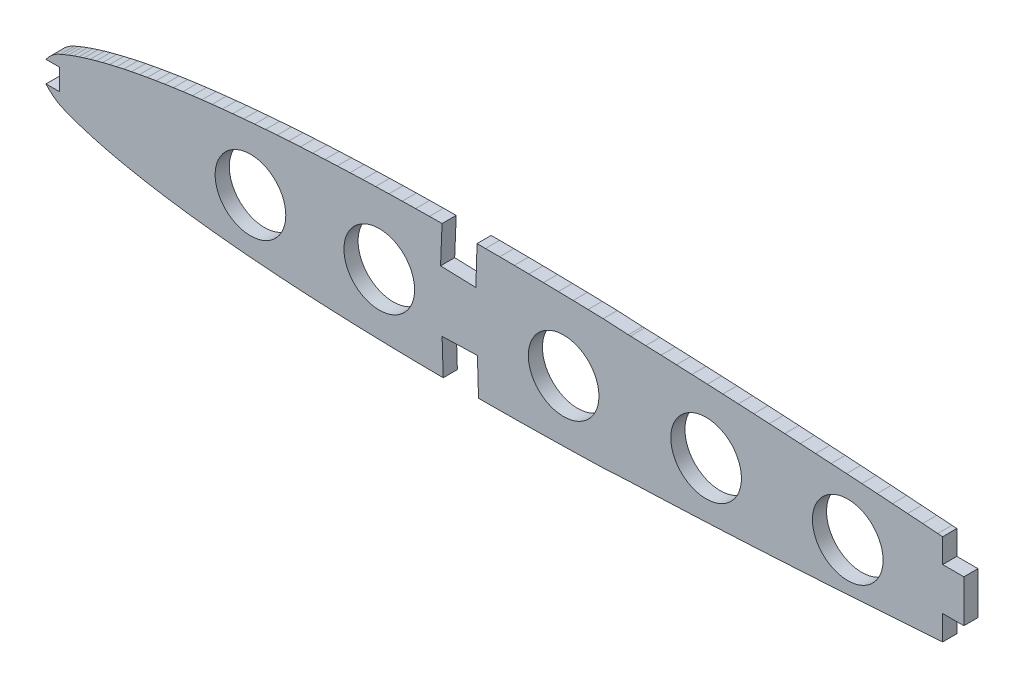
from build123d import *

# Parameters (mm, degrees)
MODEL_R         = 4.999197418
EXTRUDE_1_DEPTH = 2


with BuildPart() as part:
    # Model → 凸台-拉伸1 (new body)
    with BuildSketch(Plane.XY):
        with BuildLine():
            Line((15.194094226, 17.721853744), (17.133079466, 17.721853744))
            Line((17.133079466, 17.721853744), (17.133079466, 14.721853744))
            Line((17.133079466, 14.721853744), (15.194094226, 14.721853744))
            ThreePointArc((15.194094226, 14.721853744), (16.131604287, 13.801473468), (17.226994751, 13.076115145))
            Line((17.226994751, 13.076115145), (17.74383436, 12.854853744))
            Line((17.74383436, 12.854853744), (18.36183436, 12.607853744))
            Line((18.36183436, 12.607853744), (19.09783436, 12.332853744))
            Line((19.09783436, 12.332853744), (19.84083436, 12.076853744))
            Line((19.84083436, 12.076853744), (20.58983436, 11.836853744))
            Line((20.58983436, 11.836853744), (21.45683436, 11.576853744))
            Line((21.45683436, 11.576853744), (22.32783436, 11.331853744))
            Line((22.32783436, 11.331853744), (23.20283436, 11.101853744))
            Line((23.20283436, 11.101853744), (24.19583436, 10.855853744))
            Line((24.19583436, 10.855853744), (25.19083436, 10.622853744))
            Line((25.19083436, 10.622853744), (26.18983436, 10.403853744))
            Line((26.18983436, 10.403853744), (27.30283436, 10.174853744))
            Line((27.30283436, 10.174853744), (28.41883436, 9.959853744))
            Line((28.41883436, 9.959853744), (29.53783436, 9.756853744))
            Line((29.53783436, 9.756853744), (30.76783436, 9.546853744))
            Line((30.76783436, 9.546853744), (31.99983436, 9.349853744))
            Line((31.99983436, 9.349853744), (33.23483436, 9.164853744))
            Line((33.23483436, 9.164853744), (34.57683436, 8.974853744))
            Line((34.57683436, 8.974853744), (35.91983436, 8.797853744))
            Line((35.91983436, 8.797853744), (37.26583436, 8.632853744))
            Line((37.26583436, 8.632853744), (38.71483436, 8.465853744))
            Line((38.71483436, 8.465853744), (40.16583436, 8.310853744))
            Line((40.16583436, 8.310853744), (41.61783436, 8.165853744))
            Line((41.61783436, 8.165853744), (43.16683436, 8.020853744))
            Line((43.16683436, 8.020853744), (44.71683436, 7.887853744))
            Line((44.71683436, 7.887853744), (46.26883436, 7.763853744))
            Line((46.26883436, 7.763853744), (47.91283436, 7.642853744))
            Line((47.91283436, 7.642853744), (49.55683436, 7.531853744))
            Line((49.55683436, 7.531853744), (51.20283436, 7.430853744))
            Line((51.20283436, 7.430853744), (52.93483436, 7.333853744))
            Line((52.93483436, 7.333853744), (54.66683436, 7.246853744))
            Line((54.66683436, 7.246853744), (56.40083436, 7.168853744))
            Line((56.40083436, 7.168853744), (58.21383436, 7.095853744))
            Line((58.21383436, 7.095853744), (60.02683436, 7.031853744))
            Line((60.02683436, 7.031853744), (61.84083436, 6.975853744))
            Line((61.84083436, 6.975853744), (63.72783436, 6.926853744))
            Line((63.72783436, 6.926853744), (65.61483436, 6.885853744))
            Line((65.61483436, 6.885853744), (67.50183436, 6.852853744))
            Line((67.50183436, 6.852853744), (69.45583436, 6.826853744))
            Line((69.45583436, 6.826853744), (71.40883436, 6.808853744))
            Line((71.40883436, 6.808853744), (71.24683436, 11.805853744))
            Line((71.24683436, 11.805853744), (76.24383436, 11.967853744))
            Line((76.24383436, 11.967853744), (76.40583436, 6.796082515))
            Line((76.40583436, 6.796082515), (77.38783436, 6.797853744))
            Line((77.38783436, 6.797853744), (79.40083436, 6.808853744))
            Line((79.40083436, 6.808853744), (81.46383436, 6.825853744))
            Line((81.46383436, 6.825853744), (83.52683436, 6.850853744))
            Line((83.52683436, 6.850853744), (85.58983436, 6.881853744))
            Line((85.58983436, 6.881853744), (87.69483436, 6.919853744))
            Line((87.69483436, 6.919853744), (89.79983436, 6.964853744))
            Line((89.79983436, 6.964853744), (91.90583436, 7.015853744))
            Line((91.90583436, 7.015853744), (94.04583436, 7.072853744))
            Line((94.04583436, 7.072853744), (97.601964333, 7.270653793))
            Line((97.601964333, 7.270653793), (97.90379269, 7.281104913))
            Line((97.90379269, 7.281104913), (100.06879269, 7.362104913))
            Line((100.06879269, 7.362104913), (102.23479269, 7.447104913))
            Line((102.23479269, 7.447104913), (104.41879269, 7.538104913))
            Line((104.41879269, 7.538104913), (106.60179269, 7.634104913))
            Line((106.60179269, 7.634104913), (108.78479269, 7.734104913))
            Line((108.78479269, 7.734104913), (110.97679269, 7.840104913))
            Line((110.97679269, 7.840104913), (113.16779269, 7.951104913))
            Line((113.16779269, 7.951104913), (115.35879269, 8.067104913))
            Line((115.35879269, 8.067104913), (117.55079269, 8.189104913))
            Line((117.55079269, 8.189104913), (119.74079269, 8.314104913))
            Line((119.74079269, 8.314104913), (121.93279269, 8.442104913))
            Line((121.93279269, 8.442104913), (124.11679269, 8.572104913))
            Line((124.11679269, 8.572104913), (126.29979269, 8.704104913))
            Line((126.29979269, 8.704104913), (128.48279269, 8.840104913))
            Line((128.48279269, 8.840104913), (130.64879269, 8.980104913))
            Line((130.64879269, 8.980104913), (132.81379269, 9.124104913))
            Line((132.81379269, 9.124104913), (134.97979269, 9.271104913))
            Line((134.97979269, 9.271104913), (137.11979269, 9.419104913))
            Line((137.11979269, 9.419104913), (139.25979269, 9.570104913))
            Line((139.25979269, 9.570104913), (141.39979269, 9.724104913))
            Line((141.39979269, 9.724104913), (142.088794604, 9.774487769))
            Line((142.088794604, 9.774487769), (142.086848241, 13.259514384))
            Line((142.086848241, 13.259514384), (145.086848241, 13.259514384))
            Line((145.086848241, 13.259514384), (145.086848241, 19.259514384))
            Line((145.086848241, 19.259514384), (142.086848241, 19.259514384))
            Line((142.086848241, 19.259514384), (142.086848241, 22.673864384))
            Line((142.086848241, 22.673864384), (141.39979269, 22.724104913))
            Line((141.39979269, 22.724104913), (139.25979269, 22.878104913))
            Line((139.25979269, 22.878104913), (137.11979269, 23.029104913))
            Line((137.11979269, 23.029104913), (134.97979269, 23.177104913))
            Line((134.97979269, 23.177104913), (132.81379269, 23.324104913))
            Line((132.81379269, 23.324104913), (130.64879269, 23.468104913))
            Line((130.64879269, 23.468104913), (128.48279269, 23.608104913))
            Line((128.48279269, 23.608104913), (126.29979269, 23.744104913))
            Line((126.29979269, 23.744104913), (124.11679269, 23.877104913))
            Line((124.11679269, 23.877104913), (121.93279269, 24.006104913))
            Line((121.93279269, 24.006104913), (119.74079269, 24.134104913))
            Line((119.74079269, 24.134104913), (117.55079269, 24.260104913))
            Line((117.55079269, 24.260104913), (115.35879269, 24.381104913))
            Line((115.35879269, 24.381104913), (113.16779269, 24.497104913))
            Line((113.16779269, 24.497104913), (110.97679269, 24.608104913))
            Line((110.97679269, 24.608104913), (108.78479269, 24.714104913))
            Line((108.78479269, 24.714104913), (106.60179269, 24.814104913))
            Line((106.60179269, 24.814104913), (104.41879269, 24.910104913))
            Line((104.41879269, 24.910104913), (102.23479269, 25.001104913))
            Line((102.23479269, 25.001104913), (100.06879269, 25.086104913))
            Line((100.06879269, 25.086104913), (97.90379269, 25.167104913))
            Line((97.90379269, 25.167104913), (97.601514741, 25.177571601))
            Line((97.601514741, 25.177571601), (94.04583436, 25.370853744))
            Line((94.04583436, 25.370853744), (91.90583436, 25.427853744))
            Line((91.90583436, 25.427853744), (89.79983436, 25.478853744))
            Line((89.79983436, 25.478853744), (87.69483436, 25.523853744))
            Line((87.69483436, 25.523853744), (85.58983436, 25.561853744))
            Line((85.58983436, 25.561853744), (83.52683436, 25.592853744))
            Line((83.52683436, 25.592853744), (81.46383436, 25.617853744))
            Line((81.46383436, 25.617853744), (79.40083436, 25.635853744))
            Line((79.40083436, 25.635853744), (77.38783436, 25.645853744))
            Line((77.38783436, 25.645853744), (76.190756889, 25.64823362))
            Line((76.190756889, 25.64823362), (76.02683436, 20.178853744))
            Line((76.02683436, 20.178853744), (71.02883436, 20.340853744))
            Line((71.02883436, 20.340853744), (71.243114412, 25.633326371))
            Line((71.243114412, 25.633326371), (69.45583436, 25.616853744))
            Line((69.45583436, 25.616853744), (67.50183436, 25.591853744))
            Line((67.50183436, 25.591853744), (65.61483436, 25.558853744))
            Line((65.61483436, 25.558853744), (63.72783436, 25.516853744))
            Line((63.72783436, 25.516853744), (61.84083436, 25.467853744))
            Line((61.84083436, 25.467853744), (60.02683436, 25.411853744))
            Line((60.02683436, 25.411853744), (58.21383436, 25.347853744))
            Line((58.21383436, 25.347853744), (56.40083436, 25.274853744))
            Line((56.40083436, 25.274853744), (54.66683436, 25.196853744))
            Line((54.66683436, 25.196853744), (52.93483436, 25.109853744))
            Line((52.93483436, 25.109853744), (51.20283436, 25.013853744))
            Line((51.20283436, 25.013853744), (49.55683436, 24.911853744))
            Line((49.55683436, 24.911853744), (47.91283436, 24.801853744))
            Line((47.91283436, 24.801853744), (46.26883436, 24.680853744))
            Line((46.26883436, 24.680853744), (44.71683436, 24.556853744))
            Line((44.71683436, 24.556853744), (43.16683436, 24.422853744))
            Line((43.16683436, 24.422853744), (41.61783436, 24.277853744))
            Line((41.61783436, 24.277853744), (40.16583436, 24.132853744))
            Line((40.16583436, 24.132853744), (38.71483436, 23.977853744))
            Line((38.71483436, 23.977853744), (37.26583436, 23.810853744))
            Line((37.26583436, 23.810853744), (35.91983436, 23.645853744))
            Line((35.91983436, 23.645853744), (34.57683436, 23.468853744))
            Line((34.57683436, 23.468853744), (33.23483436, 23.279853744))
            Line((33.23483436, 23.279853744), (31.99983436, 23.093853744))
            Line((31.99983436, 23.093853744), (30.76783436, 22.896853744))
            Line((30.76783436, 22.896853744), (29.53783436, 22.686853744))
            Line((29.53783436, 22.686853744), (28.41883436, 22.483853744))
            Line((28.41883436, 22.483853744), (27.30283436, 22.268853744))
            Line((27.30283436, 22.268853744), (26.18983436, 22.039853744))
            Line((26.18983436, 22.039853744), (25.19083436, 21.820853744))
            Line((25.19083436, 21.820853744), (24.19583436, 21.588853744))
            Line((24.19583436, 21.588853744), (23.20283436, 21.341853744))
            Line((23.20283436, 21.341853744), (22.32783436, 21.111853744))
            Line((22.32783436, 21.111853744), (21.45683436, 20.867853744))
            Line((21.45683436, 20.867853744), (20.58983436, 20.606853744))
            Line((20.58983436, 20.606853744), (19.84083436, 20.366853744))
            Line((19.84083436, 20.366853744), (19.09783436, 20.110853744))
            Line((19.09783436, 20.110853744), (18.36183436, 19.836853744))
            Line((18.36183436, 19.836853744), (17.74383436, 19.588853744))
            Line((17.74383436, 19.588853744), (17.222488144, 19.365660445))
            ThreePointArc((17.222488144, 19.365660445), (16.089203867, 18.690706241), (15.194094226, 17.721853744))
        make_face()
        with Locations((62.354774691, 15.571631352)):
            Circle(MODEL_R, mode=Mode.SUBTRACT)
        with Locations((88.444584336, 15.571631352)):
            Circle(MODEL_R, mode=Mode.SUBTRACT)
        with Locations((108.610323656, 15.571631352)):
            Circle(MODEL_R, mode=Mode.SUBTRACT)
        with Locations((128.651429135, 15.571631352)):
            Circle(MODEL_R, mode=Mode.SUBTRACT)
        with Locations((44.129846481, 15.571631352)):
            Circle(MODEL_R, mode=Mode.SUBTRACT)
    extrude(amount=EXTRUDE_1_DEPTH)


solid = part.part
